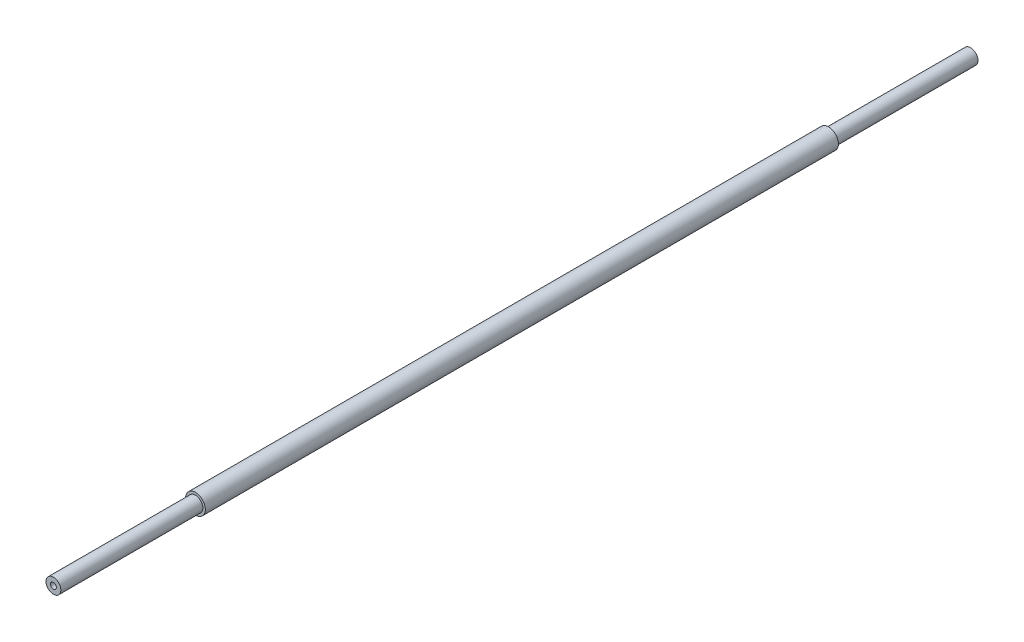
from build123d import *

# Parameters (mm, degrees)
SKETCH1_R                    = 4.7625
BOSS_EXTRUDE1_DEPTH          = 588.772
BOSS_EXTRUDE2_START          = 91.186
SKETCH1_3_R                  = 6.35
SKETCH1_3_R_2                = 4.7625
BOSS_EXTRUDE2_DEPTH          = 406.4
F_25_0_1495_DIAMETER_HOLE1_D = 3.7973


with BuildPart() as part:
    # Sketch1 → Boss-Extrude1 (new body)
    with BuildSketch(Plane.XY):
        Circle(SKETCH1_R)
    extrude(amount=BOSS_EXTRUDE1_DEPTH)

    # Sketch1<3> → Boss-Extrude2 (add)
    with BuildSketch(Plane.XY.offset(BOSS_EXTRUDE2_START)):
        Circle(SKETCH1_3_R)
        Circle(SKETCH1_3_R_2, mode=Mode.SUBTRACT)
    extrude(amount=BOSS_EXTRUDE2_DEPTH)

    # #25 (0.1495) Diameter Hole1 (through all)
    with Locations(Plane.XY.offset(588.772)):
        with Locations((0, 0)):
            Hole(F_25_0_1495_DIAMETER_HOLE1_D / 2)


solid = part.part
